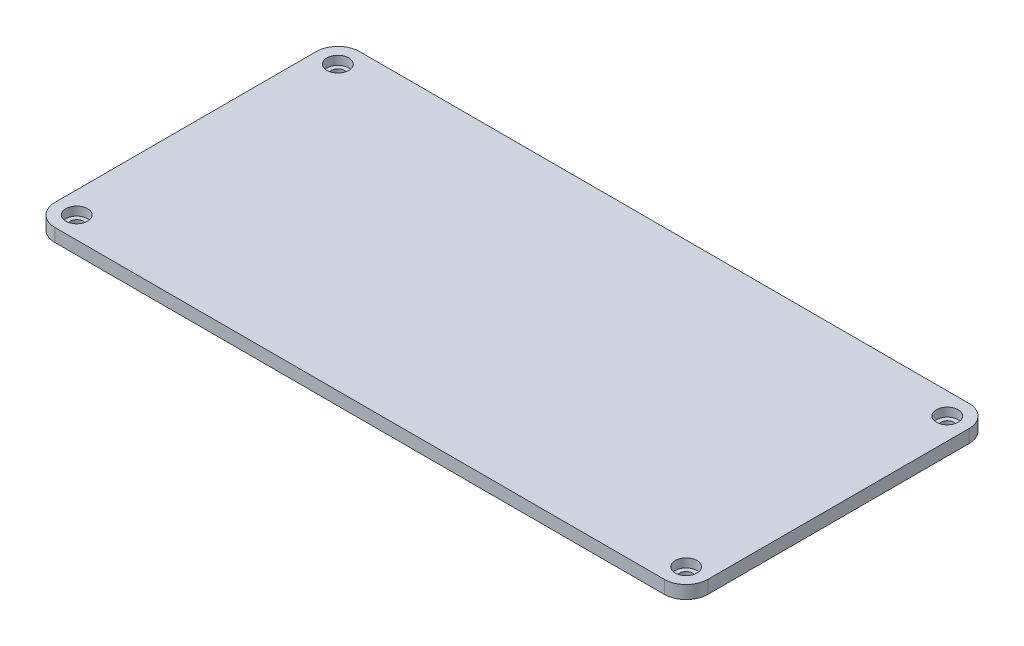
from build123d import *

# Parameters (mm, degrees)
SKETCH_1_W          = 150
SKETCH_1_H          = 70
EXTRUDE_1_DEPTH     = 3
FILLET_1_R          = 5
SKETCH_2_R          = 1.5
CUT_EXTRUDE_1_DEPTH = 3
SKETCH_3_R          = 2.5
CUT_EXTRUDE_2_DEPTH = 2
SKETCH_4_W          = 3
SKETCH_4_H          = 30
SKETCH_4_W_2        = 60
SKETCH_4_H_2        = 3
EXTRUDE_2_DEPTH     = 2


with BuildPart() as part:
    # Эскиз1 → Бобышка-Вытянуть1 (new body)
    with BuildSketch(Plane(origin=(0, 0, 0), x_dir=(1, 0, 0), z_dir=(0, 1, 0))):
        Rectangle(SKETCH_1_W, SKETCH_1_H)
    extrude(amount=EXTRUDE_1_DEPTH)

    # Скругление1
    fillet_1_edges = [part.edges().sort_by_distance(p)[0] for p in [
        (75, 1.5, -35),
        (75, 1.5, 35),
        (-75, 1.5, 35),
        (-75, 1.5, -35),
    ]]
    fillet(fillet_1_edges, radius=FILLET_1_R)

    # Эскиз2 → Вырез-Вытянуть1 (cut)
    with BuildSketch(Plane(origin=(0, 3, 0), x_dir=(1, 0, 0), z_dir=(0, 1, 0))):
        with Locations(Location((-70, 30, 0), (0, 0, 270))):
            Circle(SKETCH_2_R)
        with Locations(Location((70, 30, 0), (0, 0, 270))):
            Circle(SKETCH_2_R)
        with Locations(Location((70, -30, 0), (0, 0, 270))):
            Circle(SKETCH_2_R)
        with Locations(Location((-70, -30, 0), (0, 0, 270))):
            Circle(SKETCH_2_R)
    extrude(amount=-CUT_EXTRUDE_1_DEPTH, mode=Mode.SUBTRACT)

    # Эскиз3 → Вырез-Вытянуть2 (cut)
    with BuildSketch(Plane(origin=(0, 3, 0), x_dir=(1, 0, 0), z_dir=(0, 1, 0))):
        with Locations(Location((-70, 30, 0), (0, 0, 270))):
            Circle(SKETCH_3_R)
        with Locations(Location((70, 30, 0), (0, 0, 270))):
            Circle(SKETCH_3_R)
        with Locations(Location((70, -30, 0), (0, 0, 270))):
            Circle(SKETCH_3_R)
        with Locations(Location((-70, -30, 0), (0, 0, 270))):
            Circle(SKETCH_3_R)
    extrude(amount=-CUT_EXTRUDE_2_DEPTH, mode=Mode.SUBTRACT)

    # Эскиз4 → Бобышка-Вытянуть2 (add)
    with BuildSketch(Plane.XZ):
        with Locations((-70.5, 0)):
            Rectangle(SKETCH_4_W, SKETCH_4_H)
        with Locations((0, -30.5)):
            Rectangle(SKETCH_4_W_2, SKETCH_4_H_2)
        with Locations((70.5, 0)):
            Rectangle(SKETCH_4_W, SKETCH_4_H)
        with Locations((0, 30.5)):
            Rectangle(SKETCH_4_W_2, SKETCH_4_H_2)
    extrude(amount=EXTRUDE_2_DEPTH)


solid = part.part
